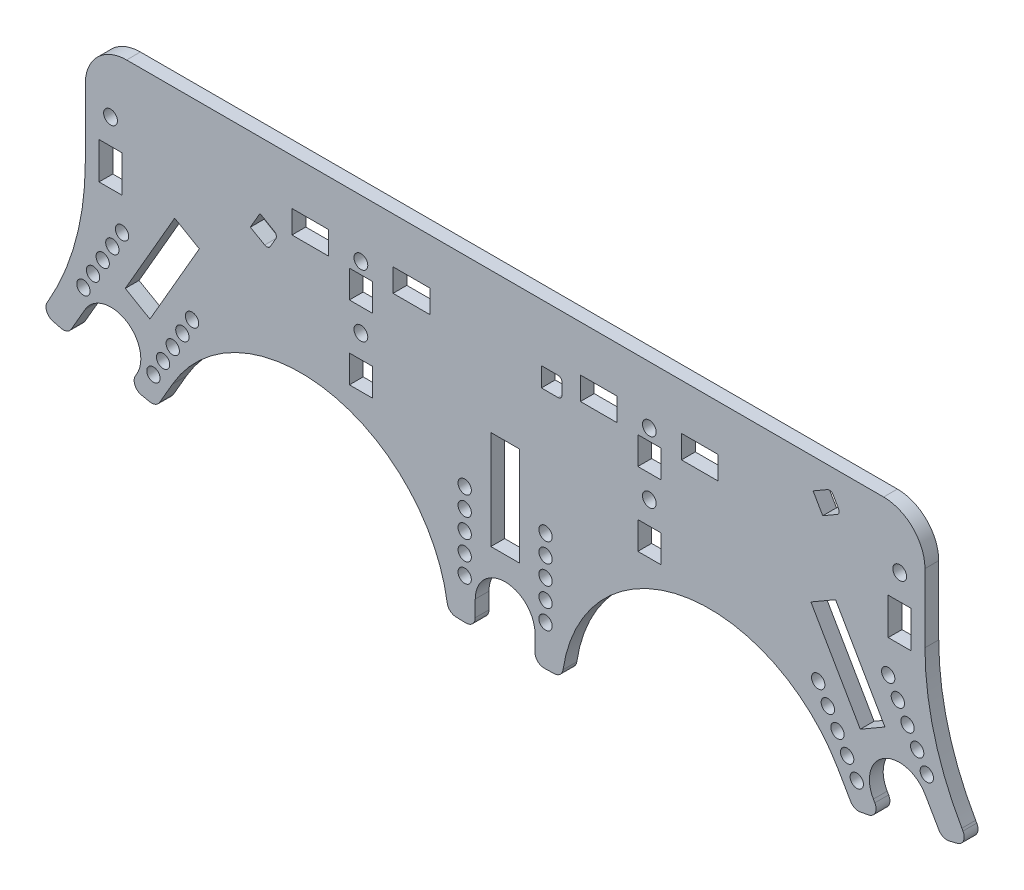
from build123d import *

# Parameters (mm, degrees)
BOSS_EXTRUDE1_DEPTH = 3
FILLET1_R           = 60
FILLET2_R           = 8
SKETCH3_R           = 1.45
SKETCH3_R_2         = 5.6
SKETCH3_W           = 9.2
SKETCH3_H           = 7.5
CUT_EXTRUDE1_DEPTH  = 125.676613305
SKETCH4_R           = 1.5
SKETCH4_W           = 8
SKETCH4_H           = 5
CUT_EXTRUDE2_DEPTH  = 125.676613305
SKETCH5_W           = 5
SKETCH5_H           = 8
CUT_EXTRUDE3_DEPTH  = 125.676613305
FILLET3_R           = 9
SKETCH6_R           = 1.5
SKETCH6_W           = 5
SKETCH6_H           = 6
CUT_EXTRUDE4_DEPTH  = 125.676613305
SKETCH7_W           = 1.5
SKETCH7_H           = 7.5
BOSS_EXTRUDE2_DEPTH = 3
SKETCH8_R           = 1.45
CUT_EXTRUDE5_DEPTH  = 125.676613305
SKETCH9_R           = 6.5
SKETCH9_W           = 6.2
SKETCH9_H           = 7
CUT_EXTRUDE6_DEPTH  = 3
CUT_EXTRUDE7_DEPTH  = 3
FILLET4_R           = 2


with BuildPart() as part:
    # Sketch1 → Boss-Extrude1 (new body)
    with BuildSketch(Plane.XY):
        Polygon((-83.391188804, -3.05320323), (-63.103878976, 32.08544814), (-12.25, 32.08544814), (-12.25, -8), (12.25, -8), (12.25, 32.08544814), (63.103878976, 32.08544814), (83.391188804, -3.05320323), (104.608811196, 9.19679677), (91.394042166, 32.08544814), (91.394042166, 72.08544814), (-91.394042166, 72.08544814), (-91.394042166, 32.08544814), (-104.608811196, 9.19679677), align=None)
        with BuildLine():
            ThreePointArc((-72.410784769, 15.965414445), (-60.610101085, 27.766098129), (-44.49006739, 32.08544814))
            Line((-44.49006739, 32.08544814), (-63.103878976, 32.08544814))
            Line((-63.103878976, 32.08544814), (-72.410784769, 15.965414445))
        make_face()
        with BuildLine():
            Line((-12.25, -0.15461925), (-12.25, 32.08544814))
            Line((-12.25, 32.08544814), (-44.49006739, 32.08544814))
            ThreePointArc((-44.49006739, 32.08544814), (-21.692897113, 22.642551027), (-12.25, -0.15461925))
        make_face()
        with BuildLine():
            Line((12.25, 32.08544814), (12.25, -0.15461925))
            ThreePointArc((12.25, -0.15461925), (21.692897113, 22.642551027), (44.49006739, 32.08544814))
            Line((44.49006739, 32.08544814), (12.25, 32.08544814))
        make_face()
        with BuildLine():
            Line((63.103878976, 32.08544814), (44.49006739, 32.08544814))
            ThreePointArc((44.49006739, 32.08544814), (60.610101085, 27.766098129), (72.410784769, 15.965414445))
            Line((72.410784769, 15.965414445), (63.103878976, 32.08544814))
        make_face()
    extrude(amount=BOSS_EXTRUDE1_DEPTH)

    # Fillet1
    fillet1_edges = [part.edges().sort_by_distance(p)[0] for p in [
        (-91.394042166, 32.08544814, 1.5),
        (91.394042166, 32.08544814, 1.5),
    ]]
    fillet(fillet1_edges, radius=FILLET1_R)

    # Fillet2
    fillet2_edges = [part.edges().sort_by_distance(p)[0] for p in [
        (-104.608811196, 9.19679677, 1.5),
        (-83.391188804, -3.05320323, 1.5),
        (-12.25, -8, 1.5),
        (12.25, -8, 1.5),
        (83.391188804, -3.05320323, 1.5),
        (104.608811196, 9.19679677, 1.5),
    ]]
    fillet(fillet2_edges, radius=FILLET2_R)

    # Sketch3 → Cut-Extrude1 (cut, through all)
    with BuildSketch(Plane.XY.offset(3)):
        with Locations((87.596023553, 31.763809346)):
            Circle(SKETCH3_R)
        with Locations((72.353976447, 22.963809346)):
            Circle(SKETCH3_R)
        with Locations((8.8, 20.05)):
            Circle(SKETCH3_R)
        with Locations((-8.8, 20.05)):
            Circle(SKETCH3_R)
        with Locations((-87.596023553, 31.763809346)):
            Circle(SKETCH3_R)
        with Locations((-72.353976447, 22.963809346)):
            Circle(SKETCH3_R)
        Circle(SKETCH3_R_2)
        with Locations((-90, 10)):
            Circle(SKETCH3_R_2)
        with Locations((90, 10)):
            Circle(SKETCH3_R_2)
        with BuildLine():
            Line((-53.35839931, 57.665114066), (-55.45839931, 54.02780737))
            Line((-55.45839931, 54.02780737), (-52.340707856, 52.22780737))
            ThreePointArc((-52.340707856, 52.22780737), (-51.657770716, 52.137896989), (-51.111284993, 52.557230233))
            Line((-51.111284993, 52.557230233), (-49.911284993, 54.635691202))
            ThreePointArc((-49.911284993, 54.635691202), (-49.821374613, 55.318628343), (-50.240707856, 55.865114066))
            Line((-50.240707856, 55.865114066), (-53.35839931, 57.665114066))
        make_face()
        with BuildLine():
            Line((7.9, 59.6), (7.9, 55.4))
            Line((7.9, 55.4), (11.5, 55.4))
            ThreePointArc((11.5, 55.4), (12.136396103, 55.663603897), (12.4, 56.3))
            Line((12.4, 56.3), (12.4, 58.7))
            ThreePointArc((12.4, 58.7), (12.136396103, 59.336396103), (11.5, 59.6))
            Line((11.5, 59.6), (7.9, 59.6))
        make_face()
        with BuildLine():
            Line((67.04160069, 65.565114066), (69.14160069, 61.92780737))
            Line((69.14160069, 61.92780737), (72.259292144, 63.72780737))
            ThreePointArc((72.259292144, 63.72780737), (72.678625387, 64.274293092), (72.588715007, 64.957230233))
            Line((72.588715007, 64.957230233), (71.388715007, 67.035691202))
            ThreePointArc((71.388715007, 67.035691202), (70.842229284, 67.455024446), (70.159292144, 67.365114066))
            Line((70.159292144, 67.365114066), (67.04160069, 65.565114066))
        make_face()
        Polygon((-68.766283143, 37.577876431), (-76.733716857, 42.177876431), (-80.483716857, 35.682685902), (-72.516283143, 31.082685902), align=None)
        with Locations((0, 30.75)):
            Rectangle(SKETCH3_W, SKETCH3_H)
        Polygon((76.733716857, 42.177876431), (68.766283143, 37.577876431), (72.516283143, 31.082685902), (80.483716857, 35.682685902), align=None)
    extrude(amount=-CUT_EXTRUDE1_DEPTH, mode=Mode.SUBTRACT)

    # Sketch4 → Cut-Extrude2 (cut, through all)
    with BuildSketch(Plane.XY.offset(3)):
        with Locations((-31.394042166, 59.58544814)):
            Circle(SKETCH4_R)
        with Locations((31.394042166, 59.58544814)):
            Circle(SKETCH4_R)
        with Locations((-85.894042166, 59.58544814)):
            Circle(SKETCH4_R)
        with Locations((85.894042166, 59.58544814)):
            Circle(SKETCH4_R)
        with Locations((-42.394042166, 59.58544814)):
            Rectangle(SKETCH4_W, SKETCH4_H)
        with Locations((-20.394042166, 59.58544814)):
            Rectangle(SKETCH4_W, SKETCH4_H)
        with Locations((20.394042166, 59.58544814)):
            Rectangle(SKETCH4_W, SKETCH4_H)
        with Locations((42.394042166, 59.58544814)):
            Rectangle(SKETCH4_W, SKETCH4_H)
    extrude(amount=-CUT_EXTRUDE2_DEPTH, mode=Mode.SUBTRACT)

    # Sketch5 → Cut-Extrude3 (cut, through all)
    with BuildSketch(Plane.XY.offset(3)):
        with Locations((-85.894042166, 50.08544814)):
            Rectangle(SKETCH5_W, SKETCH5_H)
        with Locations((85.894042166, 50.08544814)):
            Rectangle(SKETCH5_W, SKETCH5_H)
    extrude(amount=-CUT_EXTRUDE3_DEPTH, mode=Mode.SUBTRACT)

    # Fillet3
    fillet3_edges = [part.edges().sort_by_distance(p)[0] for p in [
        (-91.394042166, 72.08544814, 1.5),
        (91.394042166, 72.08544814, 1.5),
    ]]
    fillet(fillet3_edges, radius=FILLET3_R)

    # Sketch6 → Cut-Extrude4 (cut, through all)
    with BuildSketch(Plane.XY.offset(3)):
        with Locations((-31.394042166, 46.08544814)):
            Circle(SKETCH6_R)
        with Locations((31.394042166, 46.08544814)):
            Circle(SKETCH6_R)
        with Locations((31.394042166, 38.08544814)):
            Rectangle(SKETCH6_W, SKETCH6_H)
        with Locations((31.394042166, 54.08544814)):
            Rectangle(SKETCH6_W, SKETCH6_H)
        with Locations((-31.394042166, 54.08544814)):
            Rectangle(SKETCH6_W, SKETCH6_H)
        with Locations((-31.394042166, 38.08544814)):
            Rectangle(SKETCH6_W, SKETCH6_H)
    extrude(amount=-CUT_EXTRUDE4_DEPTH, mode=Mode.SUBTRACT)

    # Sketch7 → Boss-Extrude2 (add)
    with BuildSketch(Plane.XY.offset(3)):
        Polygon((-79.184678752, 34.932685902), (-75.434678752, 41.427876431), (-76.733716857, 42.177876431), (-80.483716857, 35.682685902), align=None)
        Polygon((-68.766283143, 37.577876431), (-70.065321248, 38.327876431), (-73.815321248, 31.832685902), (-72.516283143, 31.082685902), align=None)
        with Locations((-3.85, 30.75)):
            Rectangle(SKETCH7_W, SKETCH7_H)
        with Locations((3.85, 30.75)):
            Rectangle(SKETCH7_W, SKETCH7_H)
        Polygon((72.516283143, 31.082685902), (73.815321248, 31.832685902), (70.065321248, 38.327876431), (68.766283143, 37.577876431), align=None)
        Polygon((79.184678752, 34.932685902), (80.483716857, 35.682685902), (76.733716857, 42.177876431), (75.434678752, 41.427876431), align=None)
    extrude(amount=-BOSS_EXTRUDE2_DEPTH)

    # Sketch8 → Cut-Extrude5 (cut, through all)
    with BuildSketch(Plane.XY.offset(3)):
        with Locations((76.553976447, 15.689195954)):
            Circle(SKETCH8_R)
        with Locations((74.453976447, 19.32650265)):
            Circle(SKETCH8_R)
        with Locations((91.796023553, 24.489195954)):
            Circle(SKETCH8_R)
        with Locations((89.696023553, 28.12650265)):
            Circle(SKETCH8_R)
        with Locations((85.496023553, 35.401116042)):
            Circle(SKETCH8_R)
        with Locations((83.396023553, 39.038422738)):
            Circle(SKETCH8_R)
        with Locations((68.153976447, 30.238422738)):
            Circle(SKETCH8_R)
        with Locations((-8.8, 28.45)):
            Circle(SKETCH8_R)
        with Locations((-8.8, 24.25)):
            Circle(SKETCH8_R)
        with Locations((-8.8, 15.85)):
            Circle(SKETCH8_R)
        with Locations((8.8, 11.65)):
            Circle(SKETCH8_R)
        with Locations((8.8, 15.85)):
            Circle(SKETCH8_R)
        with Locations((-8.8, 11.65)):
            Circle(SKETCH8_R)
        with Locations((8.8, 24.25)):
            Circle(SKETCH8_R)
        with Locations((8.8, 28.45)):
            Circle(SKETCH8_R)
        with Locations((-70.253976447, 26.601116042)):
            Circle(SKETCH8_R)
        with Locations((-68.153976447, 30.238422738)):
            Circle(SKETCH8_R)
        with Locations((-74.453976447, 19.32650265)):
            Circle(SKETCH8_R)
        with Locations((-76.553976447, 15.689195954)):
            Circle(SKETCH8_R)
        with Locations((-85.496023553, 35.401116042)):
            Circle(SKETCH8_R)
        with Locations((-83.396023553, 39.038422738)):
            Circle(SKETCH8_R)
        with Locations((-89.696023553, 28.12650265)):
            Circle(SKETCH8_R)
        with Locations((-91.796023553, 24.489195954)):
            Circle(SKETCH8_R)
        with Locations(Location((70.253976447, 26.601116042, 0), (0, 0, 180))):
            Circle(SKETCH8_R)
    extrude(amount=-CUT_EXTRUDE5_DEPTH, mode=Mode.SUBTRACT)

    # Sketch9 → Cut-Extrude6 (cut)
    with BuildSketch(Plane.XY.offset(3)):
        Polygon((-70.065321248, 38.327876431), (-75.434678752, 41.427876431), (-71.934678752, 47.490054257), (-66.565321248, 44.390054257), align=None)
        Polygon((-82.684678752, 28.870508076), (-79.184678752, 34.932685902), (-73.815321248, 31.832685902), (-77.315321248, 25.770508076), align=None)
        with Locations((-85.8, 17.274613392)):
            Circle(SKETCH9_R)
        with Locations((-90, 10)):
            Circle(SKETCH9_R)
        with Locations((-90, 10)):
            Circle(SKETCH9_R)
        with Locations((-85.8, 17.274613392)):
            Circle(SKETCH9_R)
        with Locations((-85.8, 17.274613392)):
            Circle(SKETCH9_R)
        with Locations((-90, 10)):
            Circle(SKETCH9_R)
        with Locations((-94.2, 2.725386608)):
            Circle(SKETCH9_R)
        with Locations((-90, 10)):
            Circle(SKETCH9_R)
        with Locations((-94.2, 2.725386608)):
            Circle(SKETCH9_R)
        with Locations((-90, 10)):
            Circle(SKETCH9_R)
        with Locations((-94.2, 2.725386608)):
            Circle(SKETCH9_R)
        with BuildLine():
            Line((-95.629165106, 13.250000032), (-99.829165125, 5.975386608))
            ThreePointArc((-99.829165125, 5.975386608), (-98.367148801, 7.71386041), (-96.396219268, 8.843116655))
            ThreePointArc((-96.396219268, 8.843116655), (-96.403719436, 11.11461984), (-95.629165106, 13.250000032))
        make_face()
        with BuildLine():
            Line((-91.429165125, 20.524613392), (-95.629165106, 13.250000032))
            ThreePointArc((-95.629165106, 13.250000032), (-94.167148787, 14.988473813), (-92.196219268, 16.117730047))
            ThreePointArc((-92.196219268, 16.117730047), (-92.203719439, 18.389233214), (-91.429165125, 20.524613392))
        make_face()
        with BuildLine():
            ThreePointArc((-83.5, 10), (-83.72148221, 8.317675904), (-84.370835188, 6.749999458))
            Line((-84.370835188, 6.749999458), (-80.170834875, 14.024613392))
            ThreePointArc((-80.170834875, 14.024613392), (-81.632851199, 12.28613959), (-83.603780732, 11.156883345))
            ThreePointArc((-83.603780732, 11.156883345), (-83.525997172, 10.580764478), (-83.5, 10))
        make_face()
        with BuildLine():
            ThreePointArc((-87.7, 2.725386608), (-87.921482129, 1.043062815), (-88.570834875, -0.524613392))
            Line((-88.570834875, -0.524613392), (-84.370835188, 6.749999458))
            ThreePointArc((-84.370835188, 6.749999458), (-85.832851439, 5.011525998), (-87.803780732, 3.882269953))
            ThreePointArc((-87.803780732, 3.882269953), (-87.725997172, 3.306151086), (-87.7, 2.725386608))
        make_face()
        with Locations((0, 38)):
            Rectangle(SKETCH9_W, SKETCH9_H)
        with Locations((0, 23.5)):
            Rectangle(SKETCH9_W, SKETCH9_H)
        with Locations((0, 8.4)):
            Circle(SKETCH9_R)
        Circle(SKETCH9_R)
        with Locations((0, -8.4)):
            Circle(SKETCH9_R)
        Circle(SKETCH9_R)
        with Locations((0, 8.4)):
            Circle(SKETCH9_R)
        Circle(SKETCH9_R)
        with Locations((0, 8.4)):
            Circle(SKETCH9_R)
        Circle(SKETCH9_R)
        with Locations((0, -8.4)):
            Circle(SKETCH9_R)
        with Locations((0, -8.4)):
            Circle(SKETCH9_R)
        Circle(SKETCH9_R)
        with BuildLine():
            Line((6.5, -8.4), (6.5, 0))
            ThreePointArc((6.5, 0), (6.103093624, -2.236570638), (4.960846702, -4.2))
            ThreePointArc((4.960846702, -4.2), (6.103093624, -6.163429362), (6.5, -8.4))
        make_face()
        with BuildLine():
            Line((6.5, 0), (6.5, 8.4))
            ThreePointArc((6.5, 8.4), (6.103093624, 6.163429362), (4.960846702, 4.2))
            ThreePointArc((4.960846702, 4.2), (6.103093624, 2.236570638), (6.5, 0))
        make_face()
        with BuildLine():
            ThreePointArc((-4.960846702, 4.2), (-6.103093624, 6.163429362), (-6.5, 8.4))
            Line((-6.5, 8.4), (-6.5, 1.4e-08))
            ThreePointArc((-6.5, 1.4e-08), (-6.103093621, 2.236570645), (-4.960846702, 4.2))
        make_face()
        with BuildLine():
            ThreePointArc((-4.960846702, -4.2), (-6.103093626, -2.236570631), (-6.5, 1.4e-08))
            Line((-6.5, 1.4e-08), (-6.5, -8.4))
            ThreePointArc((-6.5, -8.4), (-6.103093624, -6.163429362), (-4.960846702, -4.2))
        make_face()
        Polygon((70.065321248, 38.327876431), (75.434678752, 41.427876431), (71.934678752, 47.490054257), (66.565321248, 44.390054257), align=None)
        Polygon((82.684678752, 28.870508076), (79.184678752, 34.932685902), (73.815321248, 31.832685902), (77.315321248, 25.770508076), align=None)
        with Locations((85.8, 17.274613392)):
            Circle(SKETCH9_R)
        with Locations((90, 10)):
            Circle(SKETCH9_R)
        with Locations((90, 10)):
            Circle(SKETCH9_R)
        with Locations((94.2, 2.725386608)):
            Circle(SKETCH9_R)
        with Locations((85.8, 17.274613392)):
            Circle(SKETCH9_R)
        with Locations((90, 10)):
            Circle(SKETCH9_R)
        with Locations((85.8, 17.274613392)):
            Circle(SKETCH9_R)
        with Locations((90, 10)):
            Circle(SKETCH9_R)
        with Locations((94.2, 2.725386608)):
            Circle(SKETCH9_R)
        with Locations((94.2, 2.725386608)):
            Circle(SKETCH9_R)
        with Locations((90, 10)):
            Circle(SKETCH9_R)
        with BuildLine():
            ThreePointArc((96.396219268, 8.843116655), (98.367148801, 7.71386041), (99.829165125, 5.975386608))
            Line((99.829165125, 5.975386608), (95.629165037, 13.250000152))
            ThreePointArc((95.629165037, 13.250000152), (96.278517848, 11.682323878), (96.5, 10))
            ThreePointArc((96.5, 10), (96.474002828, 9.419235522), (96.396219268, 8.843116655))
        make_face()
        with BuildLine():
            ThreePointArc((92.196219268, 16.117730047), (94.167148734, 14.988473858), (95.629165037, 13.250000152))
            Line((95.629165037, 13.250000152), (91.429165125, 20.524613392))
            ThreePointArc((91.429165125, 20.524613392), (92.078517871, 18.956937185), (92.3, 17.274613392))
            ThreePointArc((92.3, 17.274613392), (92.274002828, 16.693848914), (92.196219268, 16.117730047))
        make_face()
        with BuildLine():
            ThreePointArc((83.603780732, 11.156883345), (81.632851199, 12.28613959), (80.170834875, 14.024613392))
            Line((80.170834875, 14.024613392), (84.370835186, 6.749999462))
            ThreePointArc((84.370835186, 6.749999462), (83.596280614, 8.885379872), (83.603780732, 11.156883345))
        make_face()
        with BuildLine():
            Line((84.370835186, 6.749999462), (88.570834875, -0.524613392))
            ThreePointArc((88.570834875, -0.524613392), (87.796280561, 1.610766786), (87.803780732, 3.882269953))
            ThreePointArc((87.803780732, 3.882269953), (85.832851437, 5.011525999), (84.370835186, 6.749999462))
        make_face()
    extrude(amount=-CUT_EXTRUDE6_DEPTH, mode=Mode.SUBTRACT)

    # Sketch10 → Cut-Extrude7 (cut)
    with BuildSketch(Plane.XY.offset(3)):
        with BuildLine():
            ThreePointArc((133.625456238, 25.232342342), (5.64553783, 2.821918153), (-122.904337641, 21.690308238))
            Line((-122.904337641, 21.690308238), (-108.965141454, -45.801080348))
            Line((-108.965141454, -45.801080348), (156.244904936, -40.186421831))
            Line((156.244904936, -40.186421831), (133.625456238, 25.232342342))
        make_face()
    extrude(amount=-CUT_EXTRUDE7_DEPTH, mode=Mode.SUBTRACT)

    # Fillet4
    fillet4_edges = [part.edges().sort_by_distance(p)[0] for p in [
        (100.960362323, 15.442405085, 1.5),
        (81.879850525, 11.064511456, 1.5),
        (12.401874771, 2.971055038, 1.5),
        (-6.5, 2.834609156, 1.5),
        (-12.401874771, 2.971055038, 1.5),
        (6.5, 2.834609156, 1.5),
        (95.186897538, 14.01602993, 1.5),
        (75.917279423, 9.891987548, 1.5),
        (-75.917279423, 9.891987548, 1.5),
        (-81.879850525, 11.064511456, 1.5),
        (-95.186897538, 14.01602993, 1.5),
        (-100.960362323, 15.442405085, 1.5),
    ]]
    fillet(fillet4_edges, radius=FILLET4_R)


solid = part.part
